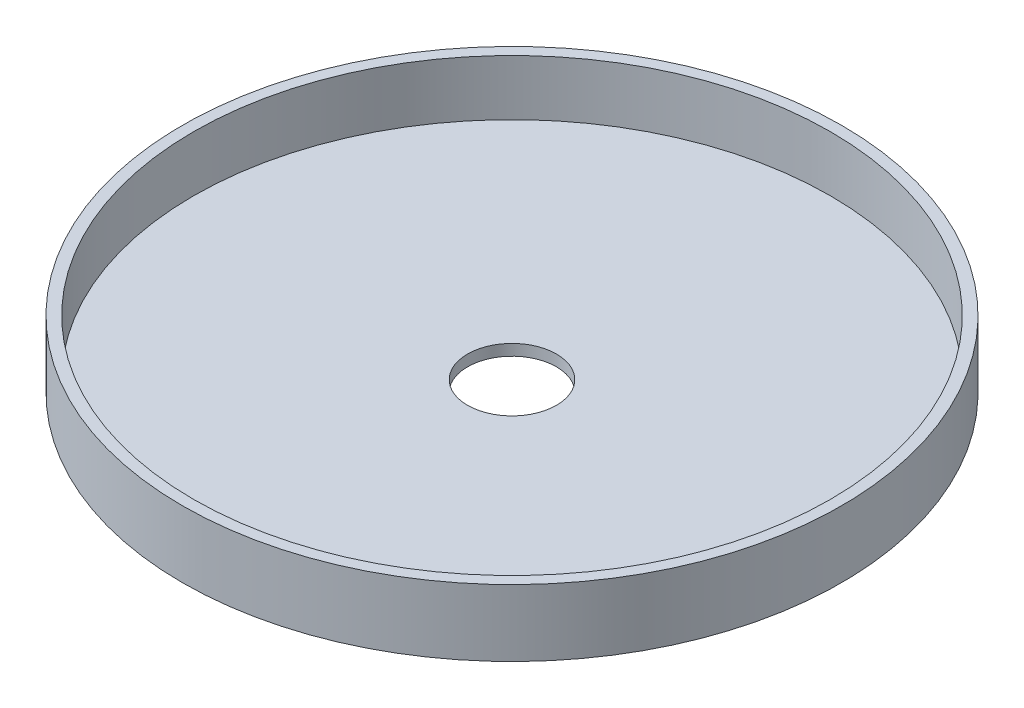
from build123d import *

# Parameters (mm, degrees)
SKETCH_1_R          = 44.5
EXTRUDE_1_DEPTH     = 1.5
SKETCH_2_R          = 44.5
SKETCH_2_R_2        = 43
EXTRUDE_2_DEPTH     = 7.5
SKETCH_3_R          = 6
CUT_EXTRUDE_1_DEPTH = 64.572792923


with BuildPart() as part:
    # Эскиз1 → Бобышка-Вытянуть1 (new body)
    with BuildSketch(Plane(origin=(0, 0, 0), x_dir=(1, 0, 0), z_dir=(0, 1, 0))):
        with Locations(Location((0, 0, 0), (0, 0, 270))):
            Circle(SKETCH_1_R)
    extrude(amount=EXTRUDE_1_DEPTH)

    # Эскиз2 → Бобышка-Вытянуть2 (add)
    with BuildSketch(Plane(origin=(0, 1.5, 0), x_dir=(1, 0, 0), z_dir=(0, 1, 0))):
        with Locations(Location((0, 0, 0), (0, 0, 270))):
            Circle(SKETCH_2_R)
        with Locations(Location((0, 0, 0), (0, 0, 270))):
            Circle(SKETCH_2_R_2, mode=Mode.SUBTRACT)
    extrude(amount=EXTRUDE_2_DEPTH)

    # Эскиз3 → Вырез-Вытянуть1 (cut, through all)
    with BuildSketch(Plane.XZ):
        with Locations(Location((0, 0, 0), (0, 0, 270))):
            Circle(SKETCH_3_R)
    extrude(amount=-CUT_EXTRUDE_1_DEPTH, mode=Mode.SUBTRACT)


solid = part.part
